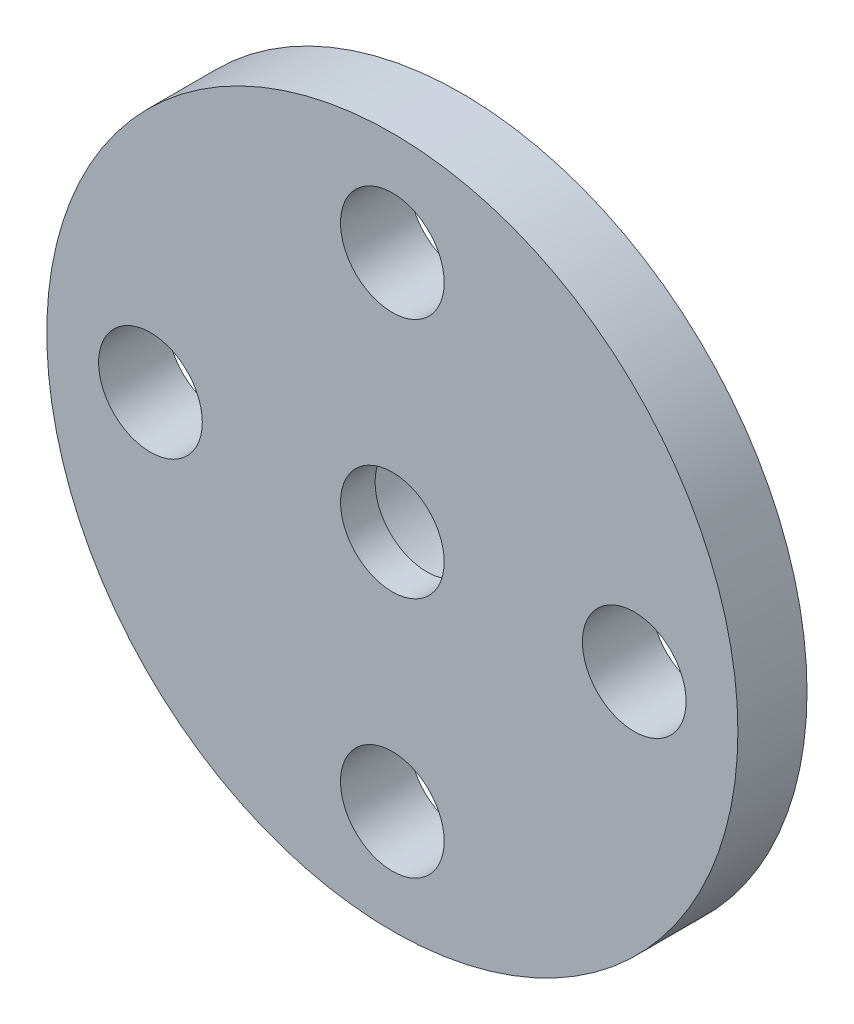
from build123d import *

# Parameters (mm, degrees)
SKETCH_1_R          = 10
SKETCH_1_R_2        = 1.5
EXTRUDE_1_DEPTH     = 2
SKETCH_2_R          = 4.5
SKETCH_2_R_2        = 2.75
EXTRUDE_2_DEPTH     = 2.5
CUT_EXTRUDE_START   = -1
SKETCH_3_R          = 2.75
CUT_EXTRUDE_1_DEPTH = 1


with BuildPart() as part:
    # 草图1 → 凸台-拉伸1 (new body)
    with BuildSketch(Plane.XY):
        Circle(SKETCH_1_R)
        Circle(SKETCH_1_R_2, mode=Mode.SUBTRACT)
        with Locations((-7, 0)):
            Circle(SKETCH_1_R_2, mode=Mode.SUBTRACT)
        with Locations((7, 0)):
            Circle(SKETCH_1_R_2, mode=Mode.SUBTRACT)
        with Locations((0, 7)):
            Circle(SKETCH_1_R_2, mode=Mode.SUBTRACT)
        with Locations((0, -7)):
            Circle(SKETCH_1_R_2, mode=Mode.SUBTRACT)
    extrude(amount=EXTRUDE_1_DEPTH)

    # 草图2 → 凸台-拉伸2 (add)
    with BuildSketch(Plane.XY):
        Circle(SKETCH_2_R)
        Circle(SKETCH_2_R_2, mode=Mode.SUBTRACT)
    extrude(amount=-EXTRUDE_2_DEPTH)

    # 草图3 → 切除-拉伸1 (cut)
    with BuildSketch(Plane(origin=(0, 0, 0), x_dir=(-1, 0, 0), z_dir=(0, 0, -1)).offset(CUT_EXTRUDE_START)):
        with Locations(Location((0, 0, 0), (0, 0, 180))):
            Circle(SKETCH_3_R)
    extrude(amount=CUT_EXTRUDE_1_DEPTH, mode=Mode.SUBTRACT)


solid = part.part
